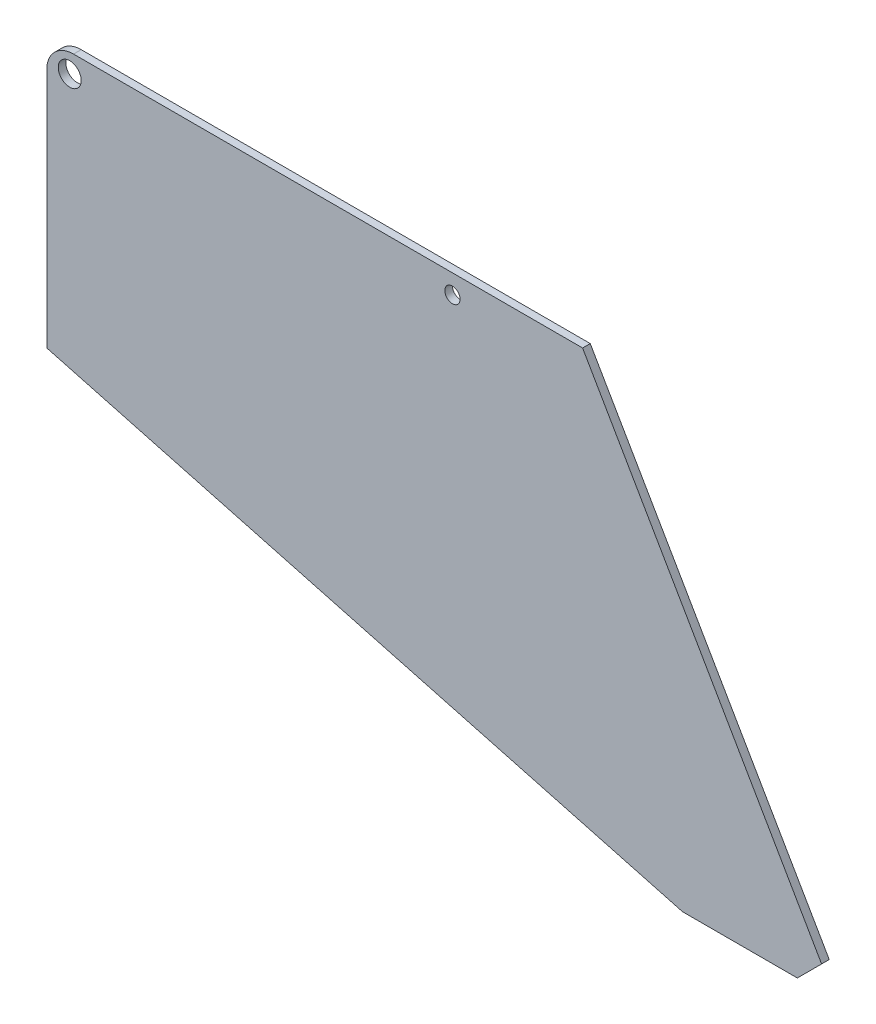
from build123d import *

# Parameters (mm, degrees)
SKETCH1_W           = 700
SKETCH1_H           = 350
BOSS_EXTRUDE2_DEPTH = 5
SKETCH2_R           = 15
SKETCH2_R_2         = 10
CUT_EXTRUDE1_DEPTH  = 10
FILLET1_R           = 35
CHAMFER1_SIZE       = 50
CHAMFER1_SIZE2      = 36.602540378


with BuildPart() as part:
    # Sketch1 → Boss-Extrude2 (new, symmetric)
    with BuildSketch(Plane.XY):
        Polygon((350, -175), (-350, -175), (480.560796608, -397.548094716), (680.560796608, -397.548094716), (350, 175), align=None)
        Rectangle(SKETCH1_W, SKETCH1_H)
    extrude(amount=BOSS_EXTRUDE2_DEPTH, both=True)

    # Sketch2 → Cut-Extrude1 (cut)
    with BuildSketch(Plane.XY.offset(5)):
        with Locations((-320, 150)):
            Circle(SKETCH2_R)
        with Locations((180, 150)):
            Circle(SKETCH2_R_2)
    extrude(amount=-CUT_EXTRUDE1_DEPTH, mode=Mode.SUBTRACT)

    # Fillet1
    fillet1_edges = [part.edges().sort_by_distance(p)[0] for p in [
        (-350, 175, 0),
    ]]
    fillet(fillet1_edges, radius=FILLET1_R)

    # Chamfer1
    chamfer1_edges = [part.edges().sort_by_distance(p)[0] for p in [
        (680.560796608, -397.548094716, 0),
    ]]
    chamfer1_side = [part.faces().sort_by_distance(p)[0] for p in [
        (580.560796608, -397.548094716, 0),
    ]]
    chamfer(chamfer1_edges, length=CHAMFER1_SIZE, length2=CHAMFER1_SIZE2, reference=chamfer1_side[0])


solid = part.part
